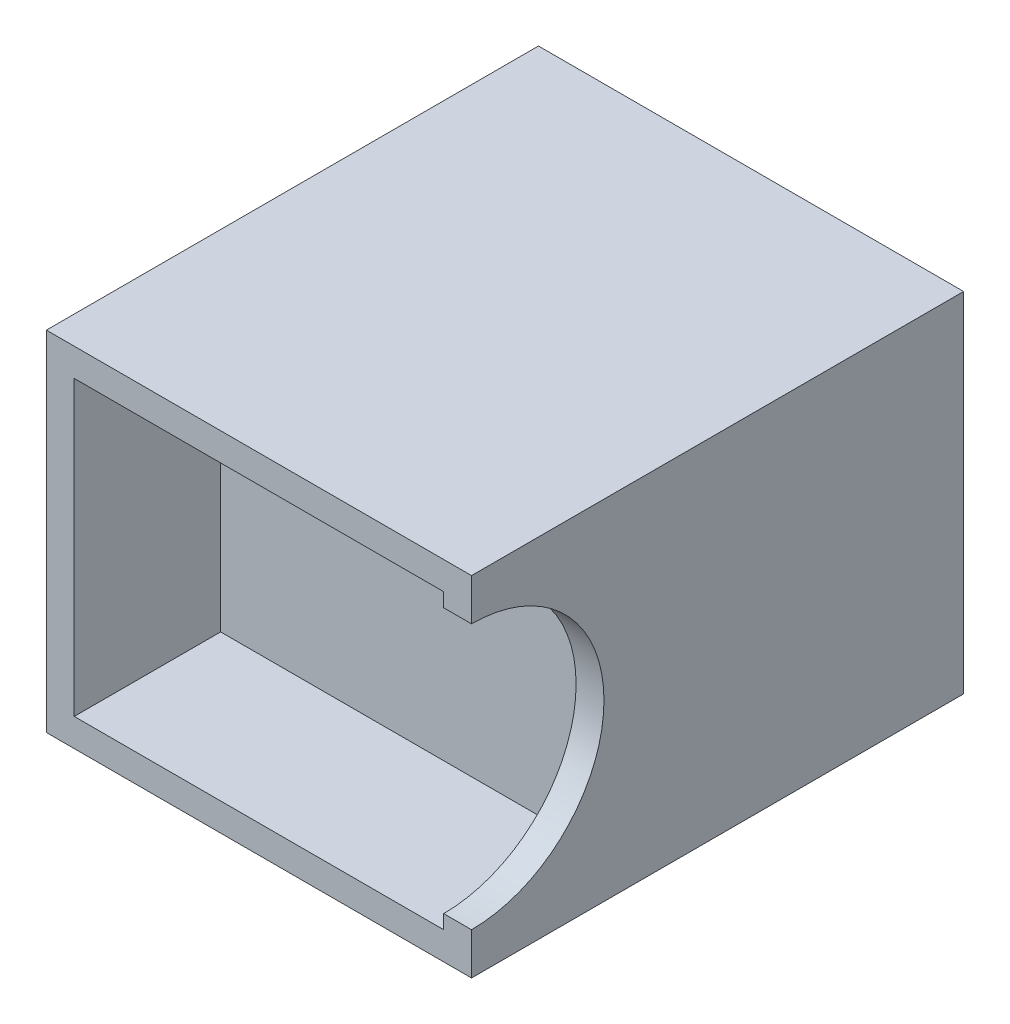
from build123d import *

# Parameters (mm, degrees)
SKETCH1_W           = 61
SKETCH1_H           = 50
SKETCH1_W_2         = 53
SKETCH1_H_2         = 42
BOSS_EXTRUDE1_DEPTH = 70.6
SKETCH2_W           = 61
SKETCH2_H           = 50
BOSS_EXTRUDE2_DEPTH = 49.6
SKETCH3_R           = 19
CUT_EXTRUDE1_DEPTH  = 10


with BuildPart() as part:
    # Sketch1 → Boss-Extrude1 (new body)
    with BuildSketch(Plane.XY):
        with Locations((30.5, 25)):
            Rectangle(SKETCH1_W, SKETCH1_H)
        with Locations((30.5, 25)):
            Rectangle(SKETCH1_W_2, SKETCH1_H_2, mode=Mode.SUBTRACT)
    extrude(amount=BOSS_EXTRUDE1_DEPTH)

    # Sketch2 → Boss-Extrude2 (add)
    with BuildSketch(Plane(origin=(0, 0, 0), x_dir=(-1, 0, 0), z_dir=(0, 0, -1))):
        with Locations((-30.5, 25)):
            Rectangle(SKETCH2_W, SKETCH2_H)
    extrude(amount=-BOSS_EXTRUDE2_DEPTH)

    # Sketch3 → Cut-Extrude1 (cut)
    with BuildSketch(Plane(origin=(61, 0, 0), x_dir=(0, 0, -1), z_dir=(1, 0, 0))):
        with Locations((-70.6, 25)):
            Circle(SKETCH3_R)
    extrude(amount=-CUT_EXTRUDE1_DEPTH, mode=Mode.SUBTRACT)


solid = part.part
